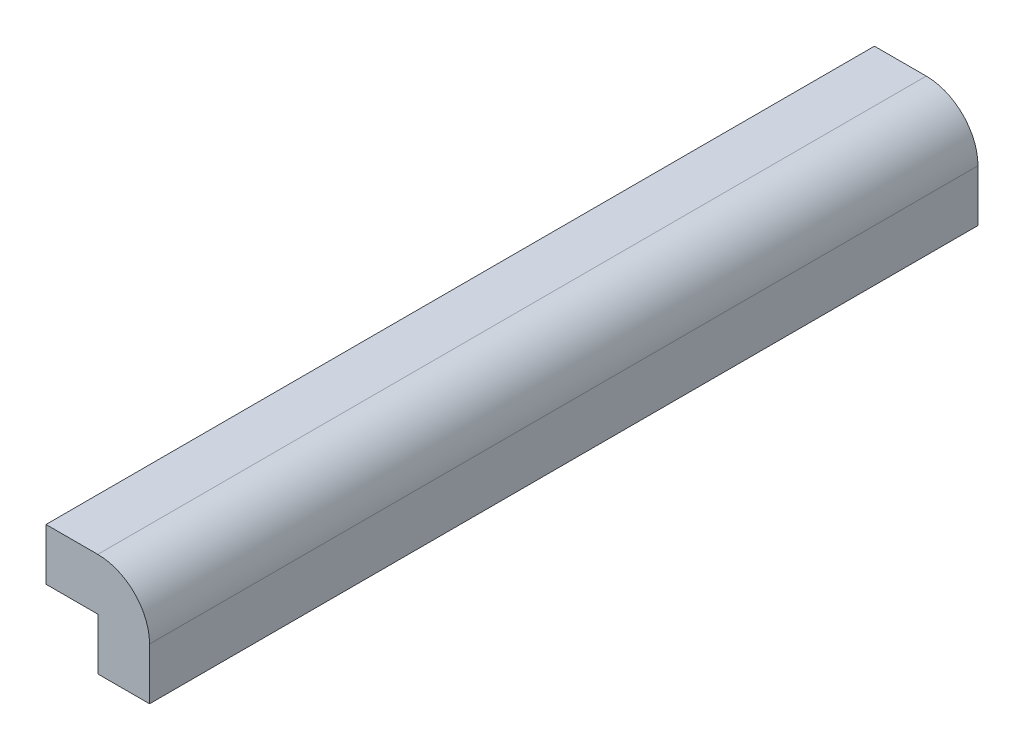
from build123d import *

# Parameters (mm, degrees)
BOSS_EXTRUDE1_DEPTH = 128


with BuildPart() as part:
    # Sketch1 → Boss-Extrude1 (new body)
    with BuildSketch(Plane.XY):
        with BuildLine():
            Line((0, 0), (-8, 0))
            Line((-8, 0), (-8, 8))
            Line((-8, 8), (0, 8))
            ThreePointArc((0, 8), (5.656854249, 5.656854249), (8, 0))
            Line((8, 0), (8, -8))
            Line((8, -8), (0, -8))
            Line((0, -8), (0, 0))
        make_face()
    extrude(amount=BOSS_EXTRUDE1_DEPTH)


solid = part.part
